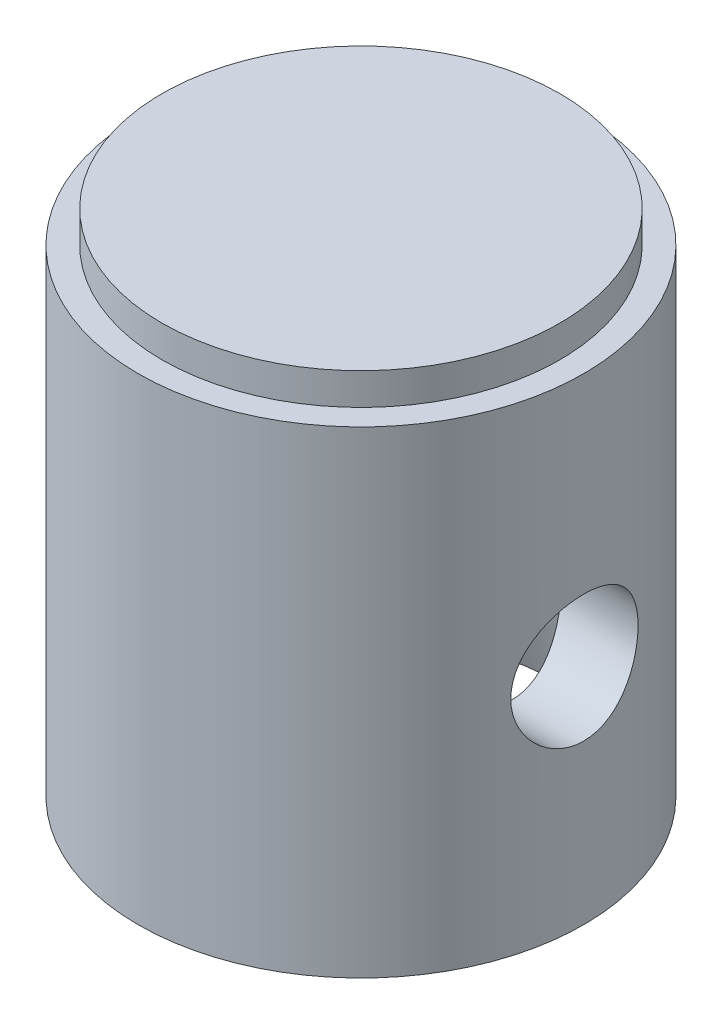
from build123d import *

# Parameters (mm, degrees)
CUT_EXTRUDE1_DEPTH      = 14.759090875
CUT_EXTRUDE1_DEPTH_BACK = 14.759090875
SKETCH2_R               = 2


with BuildPart() as part:
    # Sketch1 → Revolve1 (revolve)
    with BuildSketch(Plane.XY, mode=Mode.PRIVATE) as revolve1_sk:
        Polygon((0, 9.555761702), (0, 7.409849643), (4.75, 4.555761702), (4.75, -2.46039604), (6.2, -6.444238298), (7, -6.444238298), (7, 8.555761702), (6.25, 8.555761702), (6.25, 9.555761702), align=None)
    revolve(revolve1_sk.sketch.rotate(Axis((0, 8.108910891, 0), (0, -1, 0)), 90), axis=Axis((0, 8.108910891, 0), (0, -1, 0)))

    # Sketch2 → Cut-Extrude1 (cut, two sides: drawn at the far end of the back side and taken through both)
    with BuildSketch(Plane(origin=(0, 0, 0), x_dir=(0, 0, -1), z_dir=(1, 0, 0)).offset(-CUT_EXTRUDE1_DEPTH_BACK)):
        with Locations((0, 0.555761702)):
            Circle(SKETCH2_R)
    extrude(amount=CUT_EXTRUDE1_DEPTH + CUT_EXTRUDE1_DEPTH_BACK, mode=Mode.SUBTRACT)


solid = part.part
